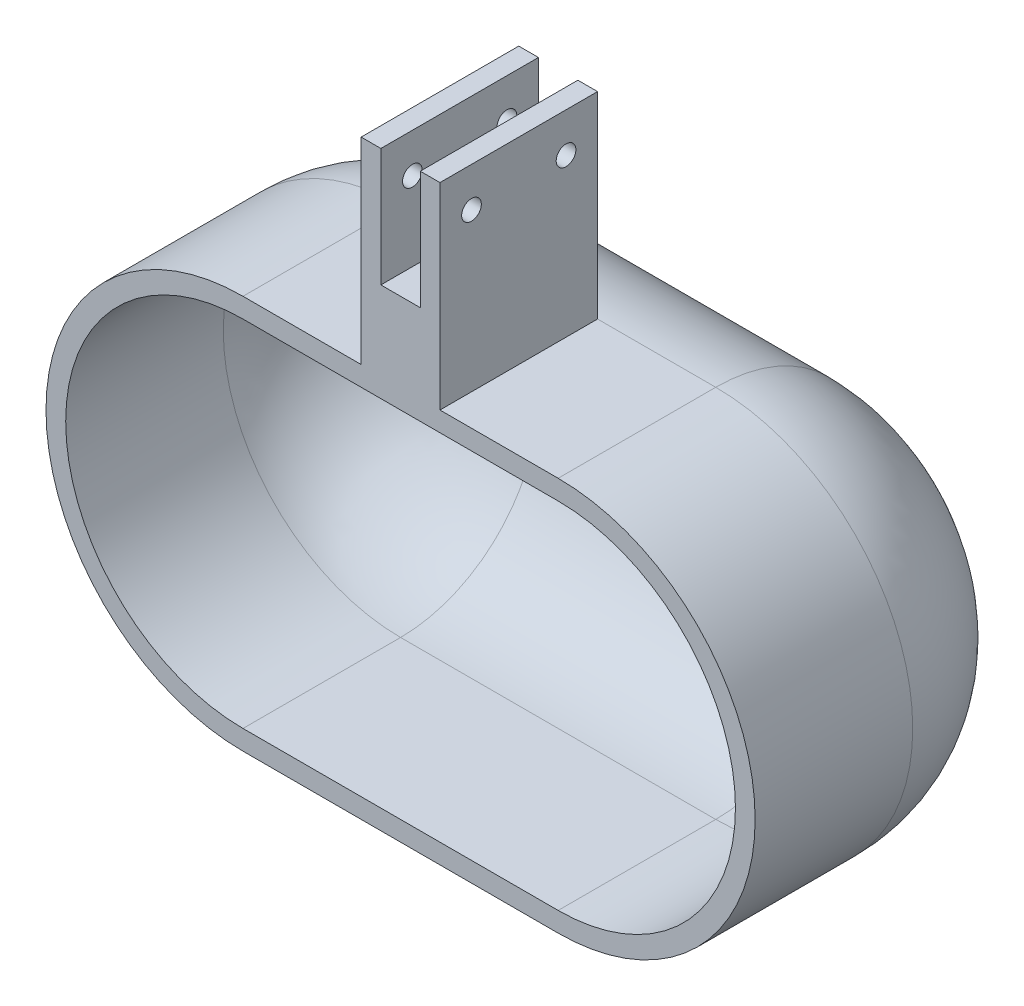
from build123d import *

# Parameters (mm, degrees)
BOSS_EXTRUDE1_DEPTH          = 80
FILLET1_R                    = 40
SHELL1_T                     = -5
SKETCH3_W                    = 20
SKETCH3_H                    = 40
BOSS_EXTRUDE2_DEPTH          = 50
CUT_EXTRUDE_THIN1_DEPTH      = 215.00934559
CUT_EXTRUDE_THIN1_DEPTH_BACK = 30
SKETCH4_W                    = 10
SKETCH4_H                    = 40
SKETCH5_R                    = 2.5
CUT_EXTRUDE1_DEPTH           = 92


with BuildPart() as part:
    # Sketch2 → Boss-Extrude1 (new body)
    with BuildSketch(Plane.XY):
        with BuildLine():
            Line((0, -50), (-80, -50))
            ThreePointArc((-80, -50), (-130, 0), (-80, 50))
            Line((-80, 50), (0, 50))
            ThreePointArc((0, 50), (50, 0), (0, -50))
        make_face()
    extrude(amount=BOSS_EXTRUDE1_DEPTH)

    # Fillet1
    fillet1_edges = [part.edges().sort_by_distance(p)[0] for p in [
        (-40, -50, 0),
        (-130, 0, 0),
        (-40, 50, 0),
        (50, 0, 0),
    ]]
    fillet(fillet1_edges, radius=FILLET1_R)

    # Shell1
    shell1_openings = [part.faces().sort_by_distance(p)[0] for p in [
        (-40, 0, 80),
    ]]
    offset(amount=SHELL1_T, openings=shell1_openings, kind=Kind.INTERSECTION)

    # Sketch3 → Boss-Extrude2 (add)
    with BuildSketch(Plane(origin=(0, 50, 0), x_dir=(1, 0, 0), z_dir=(0, 1, 0))):
        with Locations((-40, -60)):
            Rectangle(SKETCH3_W, SKETCH3_H)
    extrude(amount=BOSS_EXTRUDE2_DEPTH)

    # Sketch4 → Cut-Extrude-Thin1 (cut, two sides: drawn at the far end of the back side and taken through both)
    with BuildSketch(Plane(origin=(0, 100, 0), x_dir=(1, 0, 0), z_dir=(0, 1, 0)).offset(-CUT_EXTRUDE_THIN1_DEPTH_BACK)):
        with Locations((-40, -60)):
            Rectangle(SKETCH4_W, SKETCH4_H)
    extrude(amount=CUT_EXTRUDE_THIN1_DEPTH + CUT_EXTRUDE_THIN1_DEPTH_BACK, mode=Mode.SUBTRACT)

    # Sketch5 → Cut-Extrude1 (cut)
    with BuildSketch(Plane(origin=(-30, 0, 0), x_dir=(0, 0, -1), z_dir=(1, 0, 0))):
        with Locations((-72, 90)):
            Circle(SKETCH5_R)
        with Locations((-48, 90)):
            Circle(SKETCH5_R)
    extrude(amount=-CUT_EXTRUDE1_DEPTH, mode=Mode.SUBTRACT)


solid = part.part
